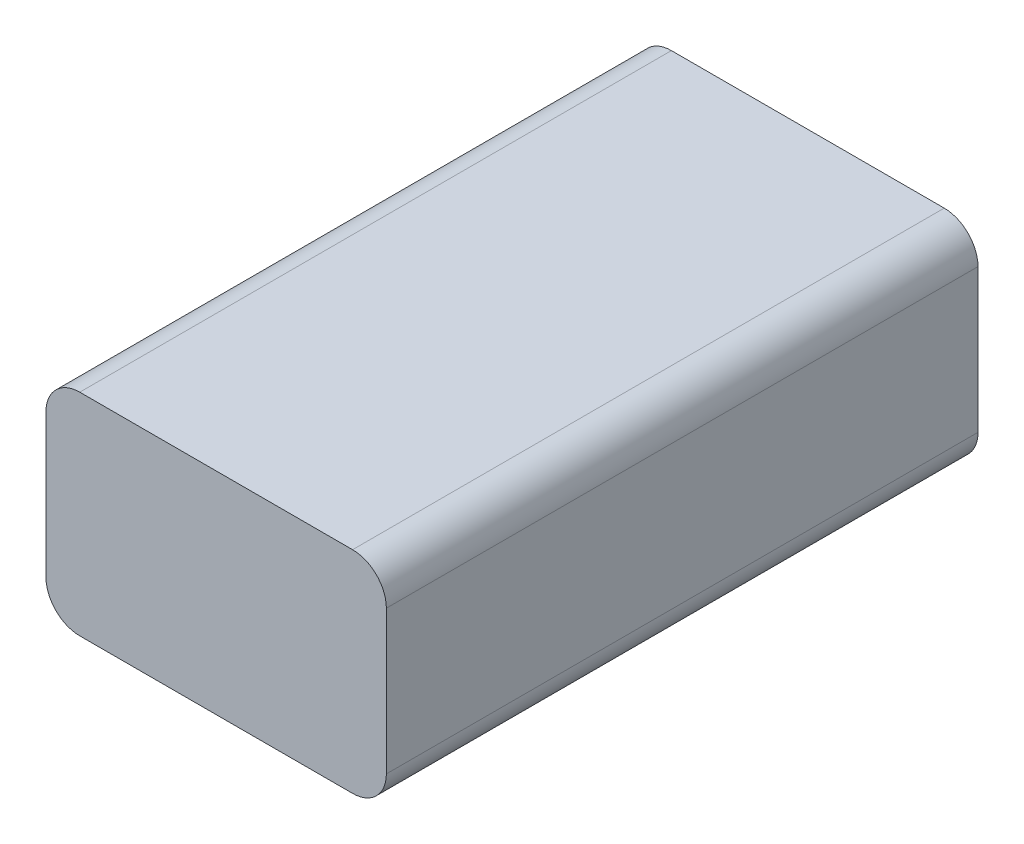
from build123d import *

# Parameters (mm, degrees)
SKETCH1_W           = 25.6
SKETCH1_H           = 44.5
BOSS_EXTRUDE1_DEPTH = 15.875
SKETCH2_R           = 3.108453975
SKETCH2_R_2         = 2.615573074
BOSS_EXTRUDE2_DEPTH = 2
FILLET1_R           = 2.54


with BuildPart() as part:
    # Sketch1 → Boss-Extrude1 (new body)
    with BuildSketch(Plane(origin=(0, 0, 0), x_dir=(1, 0, 0), z_dir=(0, 1, 0))):
        with Locations((12.8, 22.25)):
            Rectangle(SKETCH1_W, SKETCH1_H)
    extrude(amount=BOSS_EXTRUDE1_DEPTH)

    # Sketch2 → Boss-Extrude2 (add)
    # profile 1 of 2: a face of its own
    with BuildSketch(Plane(origin=(0, 0, -44.5), x_dir=(-1, 0, 0), z_dir=(0, 0, -1))):
        with Locations(Location((-6.0691761, 7.9375, 0), (0, 0, 180))):
            Circle(SKETCH2_R)
        with Locations((-6.0691761, 7.9375)):
            Circle(SKETCH2_R_2, mode=Mode.SUBTRACT)
    # profile 2 of 2: a face of its own
    with BuildSketch(Plane(origin=(0, 0, -44.5), x_dir=(-1, 0, 0), z_dir=(0, 0, -1))):
        Polygon((-19.490234753, 3.127434709), (-14.490131947, 4.087133188), (-12.821203807, 8.897198479), (-16.152378472, 12.747565291), (-21.152481278, 11.787866812), (-22.821409419, 6.977801521), align=None)
        Polygon((-19.252657716, 3.767035883), (-14.925254294, 4.612681525), (-13.493903191, 8.783145641), (-16.38995551, 12.107964117), (-20.717358932, 11.262318475), (-22.148710035, 7.091854359), align=None, mode=Mode.SUBTRACT)
    extrude(amount=BOSS_EXTRUDE2_DEPTH)

    # Fillet1
    fillet1_edges = [part.edges().sort_by_distance(p)[0] for p in [
        (25.6, 15.875, -22.25),
        (0, 15.875, -22.25),
        (25.6, 0, -22.25),
        (0, 0, -22.25),
    ]]
    fillet(fillet1_edges, radius=FILLET1_R)


solid = part.part
